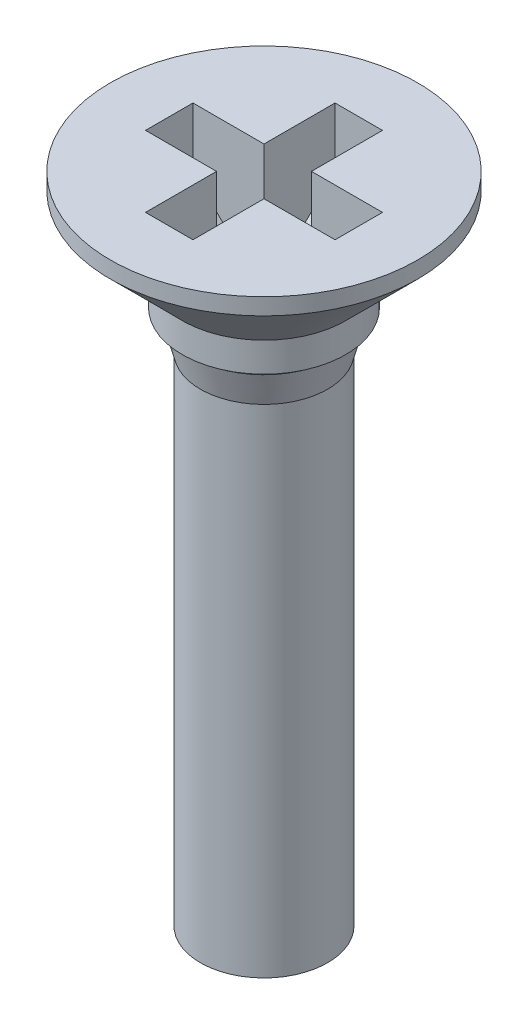
from build123d import *

# Parameters (mm, degrees)
KREUZSCHLITZ1_H_DEPTH      = 0.363
KREUZSCHLITZ1_H_DEPTH_BACK = 0.363
KREUZSCHLITZ2_H_DEPTH      = 0.363
KREUZSCHLITZ2_H_DEPTH_BACK = 0.363


with BuildPart() as part:
    # Skizze1 → Basis-Rotation (revolve)
    with BuildSketch(Plane.XY, mode=Mode.PRIVATE) as basis_rotation_sk:
        Polygon((0, 0), (2.35, 0), (2.35, -0.254), (1.25, -1.354), (1.25, -1.804), (1.104, -1.804), (1.104, -1.914833395), (0.974, -2.4), (0.974, -10), (0, -10), align=None)
    revolve(basis_rotation_sk.sketch.rotate(Axis((0, 0, 0), (0, -1, 0)), 180), axis=Axis((0, 0, 0), (0, -1, 0)))

    # Skizze2 → Kreuzschlitz1 H (cut, two sides: drawn at the far end of the back side and taken through both)
    with BuildSketch(Plane.XY.offset(-KREUZSCHLITZ1_H_DEPTH_BACK)):
        Polygon((-0.55, -1.8), (0.55, -1.8), (1.45, -0.9), (1.45, 0), (-1.45, 0), (-1.45, -0.9), align=None)
    extrude(amount=KREUZSCHLITZ1_H_DEPTH + KREUZSCHLITZ1_H_DEPTH_BACK, mode=Mode.SUBTRACT)

    # Skizze3 → Kreuzschlitz2 H (cut, two sides: drawn at the far end of the back side and taken through both)
    with BuildSketch(Plane(origin=(0, 0, 0), x_dir=(0, 0, -1), z_dir=(1, 0, 0)).offset(-KREUZSCHLITZ2_H_DEPTH_BACK)):
        Polygon((-0.55, -1.8), (0.55, -1.8), (1.45, -0.9), (1.45, 0), (-1.45, 0), (-1.45, -0.9), align=None)
    extrude(amount=KREUZSCHLITZ2_H_DEPTH + KREUZSCHLITZ2_H_DEPTH_BACK, mode=Mode.SUBTRACT)


solid = part.part
